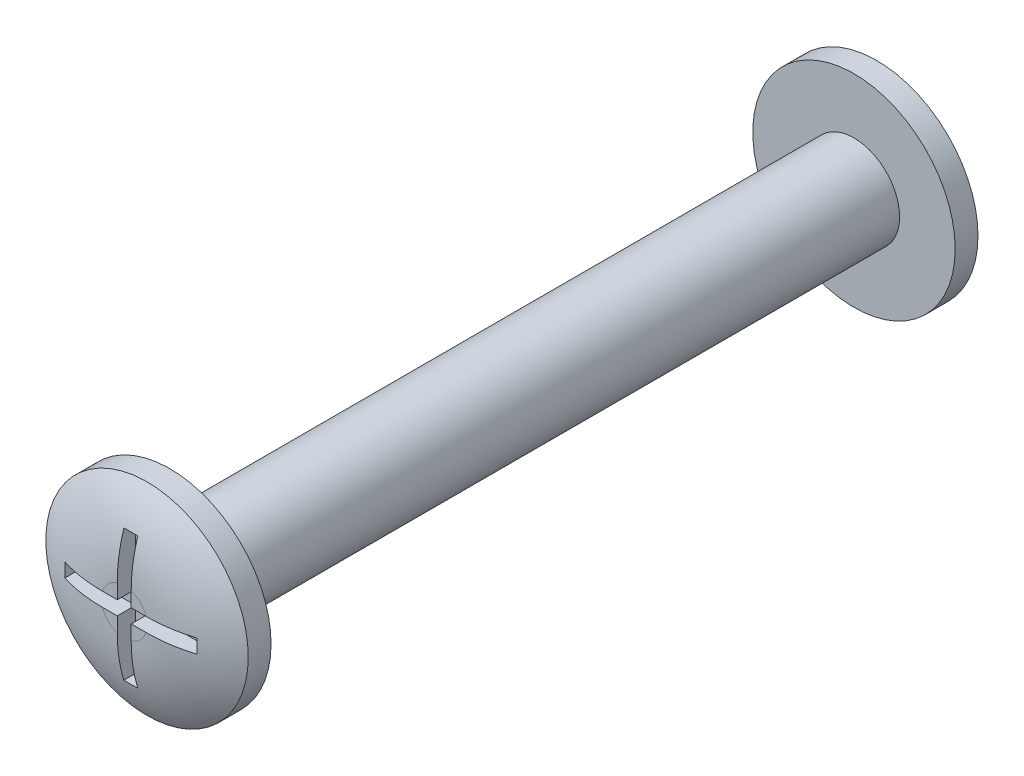
from build123d import *

# Parameters (mm, degrees)
SKETCH2_W          = 9.186415934
SKETCH2_H          = 0.97118121
SKETCH2_W_2        = 0.97118121
SKETCH2_H_2        = 9.186415934
CUT_EXTRUDE1_DEPTH = 1.27


with BuildPart() as part:
    # Sketch1 → Revolve1 (revolve)
    with BuildSketch(Plane(origin=(0, 0, 0), x_dir=(1, 0, 0), z_dir=(0, 1, 0))):
        with BuildLine():
            Line((0, 47.625), (0, 0))
            Line((0, 0), (0, -3.175))
            Line((0, -3.175), (1.5875, -3.175))
            ThreePointArc((1.5875, -3.175), (4.429777637, -2.770069708), (7.045889178, -1.5875))
            Line((7.045889178, -1.5875), (7.045889178, 0))
            Line((7.045889178, 0), (3.175, 0))
            Line((3.175, 0), (3.175, 47.625))
            Line((3.175, 47.625), (7.045889178, 47.625))
            Line((7.045889178, 47.625), (7.045889178, 49.2125))
            ThreePointArc((7.045889178, 49.2125), (4.429777637, 50.395069708), (1.5875, 50.8))
            Line((1.5875, 50.8), (0, 50.8))
            Line((0, 50.8), (0, 47.625))
        make_face()
    revolve(axis=Axis((0, 0, 0), (0, 0, -1)))

    # Sketch2 → Cut-Extrude1 (cut)
    with BuildSketch(Plane.XY.offset(3.175)):
        Rectangle(SKETCH2_W, SKETCH2_H)
        Rectangle(SKETCH2_W_2, SKETCH2_H_2)
    cut_extrude1 = extrude(amount=-CUT_EXTRUDE1_DEPTH, mode=Mode.SUBTRACT)

    # Mirror1: Cut-Extrude1 across plane
    add(cut_extrude1.mirror(Plane(origin=(0, 0, -23.8125), x_dir=(1, 0, 0), z_dir=(0, 0, -1))), mode=Mode.SUBTRACT)


solid = part.part
